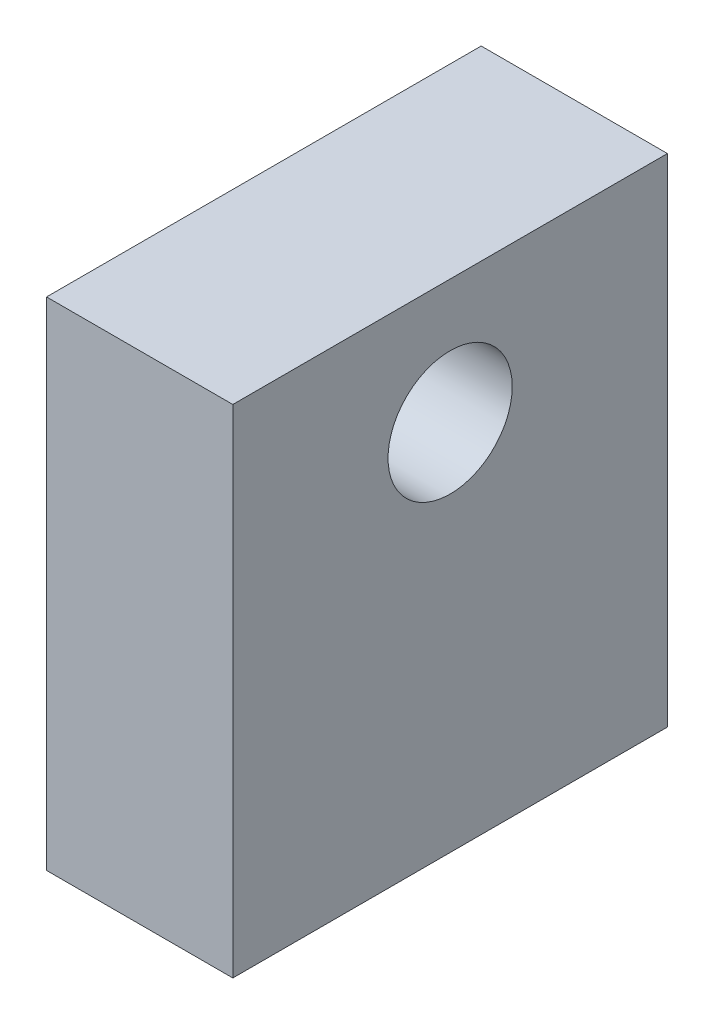
from build123d import *

# Parameters (mm, degrees)
SKETCH1_W           = 38.1
SKETCH1_H           = 88.9
BOSS_EXTRUDE1_DEPTH = 101.6
SKETCH2_R           = 12.7
CUT_EXTRUDE1_DEPTH  = 101.6


with BuildPart() as part:
    # Sketch1 → Boss-Extrude1 (new body)
    with BuildSketch(Plane(origin=(0, 0, 0), x_dir=(1, 0, 0), z_dir=(0, 1, 0))):
        with Locations((19.05, 44.45)):
            Rectangle(SKETCH1_W, SKETCH1_H)
    extrude(amount=BOSS_EXTRUDE1_DEPTH)

    # Sketch2 → Cut-Extrude1 (cut)
    with BuildSketch(Plane(origin=(38.1, 0, 0), x_dir=(0, 0, -1), z_dir=(1, 0, 0))):
        with Locations((44.45, 76.2)):
            Circle(SKETCH2_R)
    extrude(amount=-CUT_EXTRUDE1_DEPTH, mode=Mode.SUBTRACT)


solid = part.part
